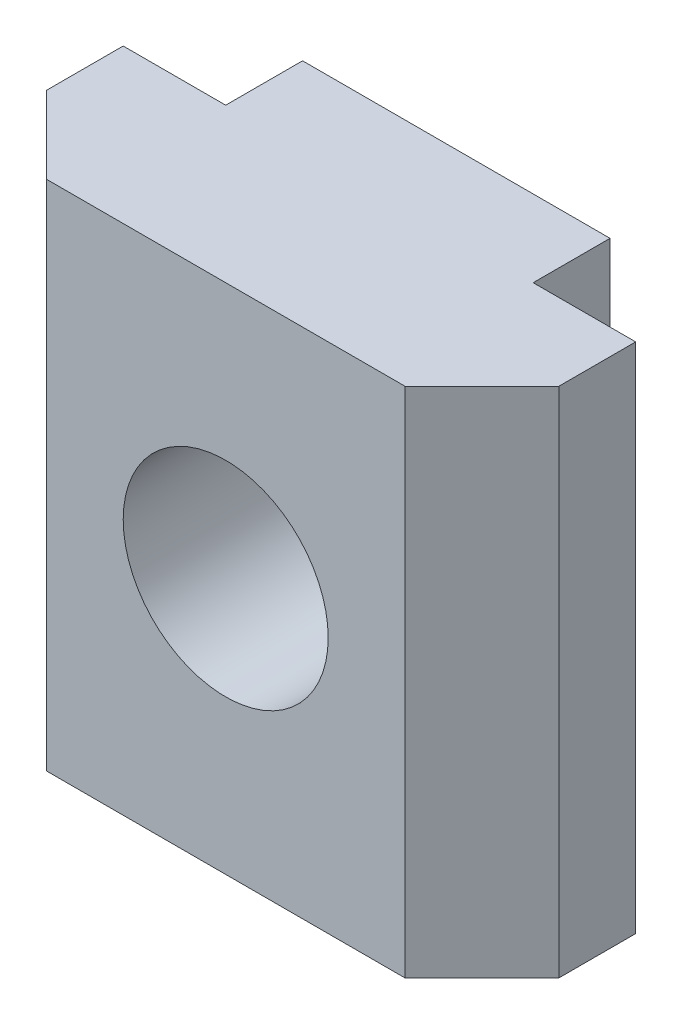
from build123d import *

# Parameters (mm, degrees)
EXTRUDE_1_DEPTH     = 10
SKETCH_2_R          = 2
CUT_EXTRUDE_1_DEPTH = 13.051970793


with BuildPart() as part:
    # 草图1 → 凸台-拉伸1 (new body)
    with BuildSketch(Plane(origin=(0, 0, 0), x_dir=(1, 0, 0), z_dir=(0, 1, 0))):
        Polygon((-3.5, 0), (3.5, 0), (5, 1.5), (5, 3), (3, 3), (3, 4.5), (-3, 4.5), (-3, 3), (-5, 3), (-5, 1.5), align=None)
    extrude(amount=EXTRUDE_1_DEPTH)

    # 草图2 → 切除-拉伸1 (cut, through all)
    with BuildSketch(Plane.XY):
        with Locations((0, 5)):
            Circle(SKETCH_2_R)
    extrude(amount=-CUT_EXTRUDE_1_DEPTH, mode=Mode.SUBTRACT)


solid = part.part
